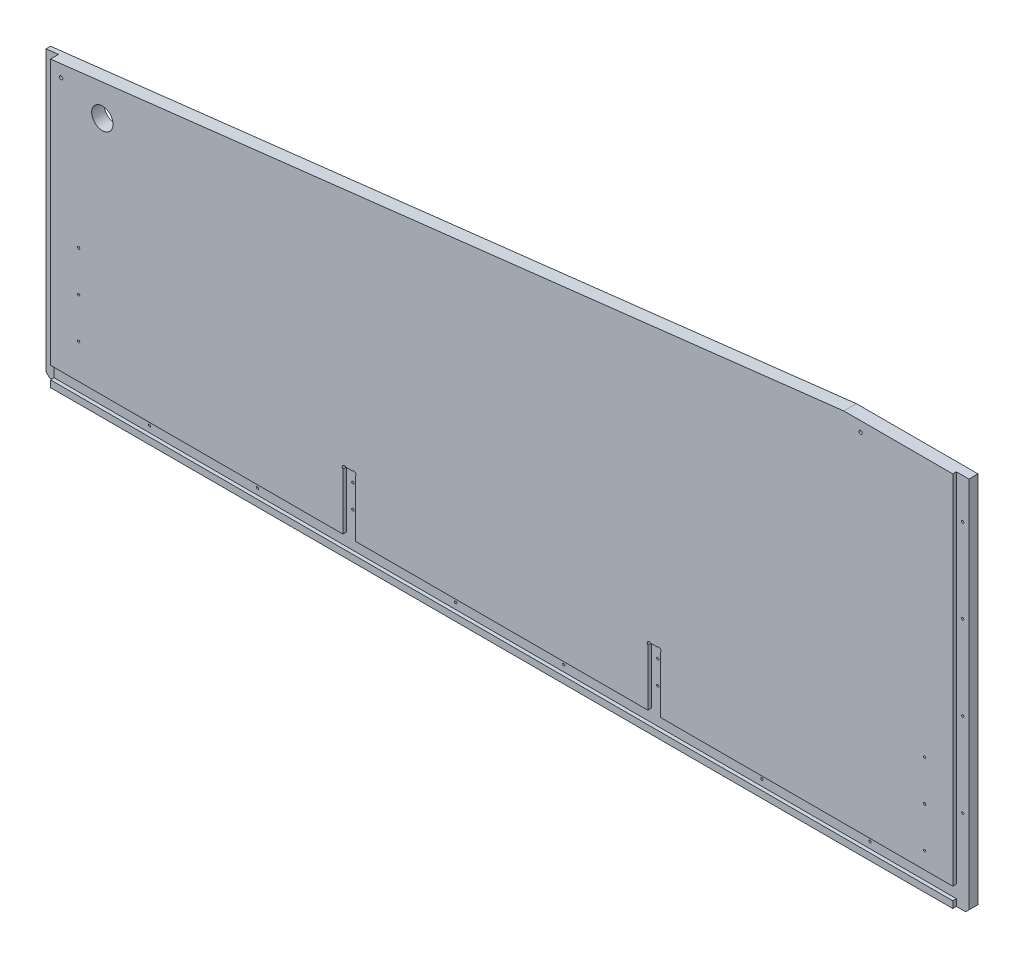
from build123d import *

# Parameters (mm, degrees)
EXTRUDE1_DEPTH     = 17.78
CUT_EXTRUDE1_DEPTH = 5.08
SKETCH4_W          = 25.7175
SKETCH4_H          = 413.5501
CUT_EXTRUDE2_DEPTH = 11.43
SKETCH5_R          = 15.08125
SKETCH5_R_2        = 2.36855
SKETCH5_R_3        = 1.5875
CUT_EXTRUDE3_DEPTH = 17.78


with BuildPart() as part:
    # Sketch2 → Extrude1 (new body)
    with BuildSketch(Plane.XY):
        Polygon((10946.341666666, -4853.78125), (10946.341666666, -5248.275), (10951.104166666, -5253.0375), (12249.679166666, -5253.0375), (12254.441666666, -5248.275), (12254.441666666, -4722.091838581), (12082.991666666, -4722.091838581), align=None)
    extrude(amount=-EXTRUDE1_DEPTH)

    # Sketch3 → Cut-Extrude1 (cut)
    with BuildSketch(Plane.XY):
        with BuildLine():
            Line((10943.166666666, -5225.7325), (10943.166666666, -5243.5125))
            Line((10943.166666666, -5243.5125), (12236.661666666, -5243.5125))
            Line((12236.661666666, -5243.5125), (12236.661666666, -5256.2125))
            Line((12236.661666666, -5256.2125), (12257.616666666, -5256.2125))
            Line((12257.616666666, -5256.2125), (12257.616666666, -4715.591300541))
            Line((12257.616666666, -4715.591300541), (12236.661666666, -4715.591300541))
            Line((12236.661666666, -4715.591300541), (12236.661666666, -5225.7325))
            Line((12236.661666666, -5225.7325), (11824.335, -5225.7325))
            Line((11824.335, -5225.7325), (11824.335, -5146.402628061))
            ThreePointArc((11824.335, -5146.402628061), (11824.335, -5141.9125), (11819.844871939, -5141.9125))
            Line((11819.844871939, -5141.9125), (11811.045128061, -5141.9125))
            ThreePointArc((11811.045128061, -5141.9125), (11806.555, -5141.912499999), (11806.554999999, -5146.402628059))
            Line((11806.554999999, -5146.402628059), (11806.555, -5225.7325))
            Line((11806.555, -5225.7325), (11394.228333334, -5225.7325))
            Line((11394.228333334, -5225.7325), (11394.228333334, -5146.402628061))
            ThreePointArc((11394.228333334, -5146.402628061), (11394.228333334, -5141.912499999), (11389.738205272, -5141.912499999))
            Line((11389.738205272, -5141.912499999), (11380.938461393, -5141.912499999))
            ThreePointArc((11380.938461393, -5141.912499999), (11376.448333333, -5141.9125), (11376.448333334, -5146.402628061))
            Line((11376.448333334, -5146.402628061), (11376.448333334, -5225.7325))
            Line((11376.448333334, -5225.7325), (10943.166666666, -5225.7325))
        make_face()
    extrude(amount=-CUT_EXTRUDE1_DEPTH, mode=Mode.SUBTRACT)

    # Sketch4 → Cut-Extrude2 (cut)
    with BuildSketch(Plane.XY):
        with Locations((10951.262916666, -5051.02495)):
            Rectangle(SKETCH4_W, SKETCH4_H)
    extrude(amount=-CUT_EXTRUDE2_DEPTH, mode=Mode.SUBTRACT)

    # Sketch5 → Cut-Extrude3 (cut)
    with BuildSketch(Plane.XY):
        with Locations((11037.231463428, -4887.549352662)):
            Circle(SKETCH5_R)
        with Locations((10979.132281191, -4867.008218481)):
            Circle(SKETCH5_R_2)
        with Locations((10955.231666666, -4929.98125)):
            Circle(SKETCH5_R_3)
        with Locations((10955.231666666, -5031.58125)):
            Circle(SKETCH5_R_3)
        with Locations((11003.809166666, -5062.5375)):
            Circle(SKETCH5_R_3)
        with Locations((11003.809166666, -5119.6875)):
            Circle(SKETCH5_R_3)
        with Locations((11003.809166666, -5176.8375)):
            Circle(SKETCH5_R_3)
        with Locations((11251.141666666, -5234.6225)):
            Circle(SKETCH5_R_3)
        with Locations((11098.741666666, -5234.6225)):
            Circle(SKETCH5_R_3)
        with Locations((11385.338333334, -5160.9625)):
            Circle(SKETCH5_R_3)
        with Locations((11385.338333334, -5193.9825)):
            Circle(SKETCH5_R_3)
        with Locations((11530.541666666, -5234.6225)):
            Circle(SKETCH5_R_3)
        with Locations((11682.941666666, -5234.6225)):
            Circle(SKETCH5_R_3)
        with Locations((11815.445, -5160.9625)):
            Circle(SKETCH5_R_3)
        with Locations((11815.445, -5193.9825)):
            Circle(SKETCH5_R_3)
        with Locations((11962.341666666, -5234.6225)):
            Circle(SKETCH5_R_3)
        with Locations((12114.741666666, -5234.6225)):
            Circle(SKETCH5_R_3)
        with Locations((12196.974166666, -5202.2375)):
            Circle(SKETCH5_R_3)
        with Locations((12196.974166666, -5145.0875)):
            Circle(SKETCH5_R_3)
        with Locations((12245.551666666, -5134.504166666)):
            Circle(SKETCH5_R_3)
        with Locations((12196.974166666, -5087.9375)):
            Circle(SKETCH5_R_3)
        with Locations((12245.551666666, -5015.970833334)):
            Circle(SKETCH5_R_3)
        with Locations((12245.551666666, -4897.4375)):
            Circle(SKETCH5_R_3)
        with Locations((12245.551666666, -4778.904166666)):
            Circle(SKETCH5_R_3)
        with Locations((12106.652677233, -4736.376540025)):
            Circle(SKETCH5_R_2)
    extrude(amount=-CUT_EXTRUDE3_DEPTH, mode=Mode.SUBTRACT)


solid = part.part
